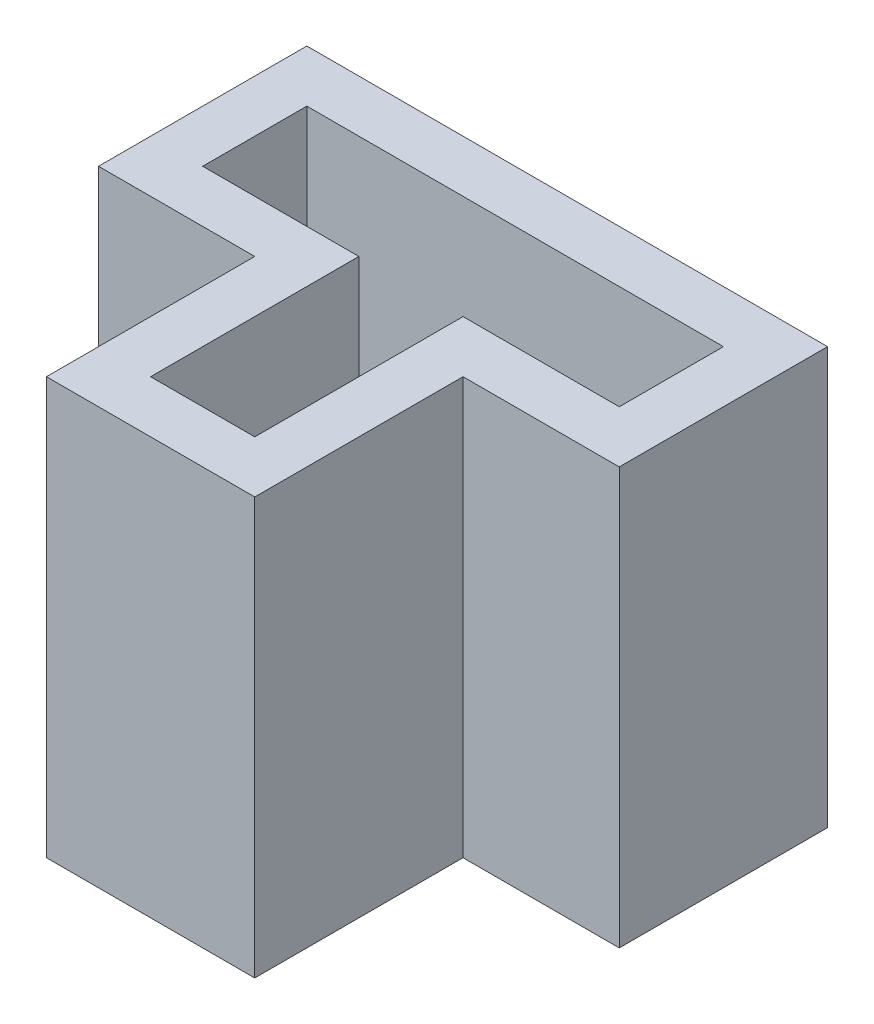
from build123d import *

# Parameters (mm, degrees)
BOSS_EXTRUDE2_DEPTH = 40
CUT_EXTRUDE1_DEPTH  = 40


with BuildPart() as part:
    # Sketch1 → Boss-Extrude2 (new body)
    with BuildSketch(Plane(origin=(0, 0, 0), x_dir=(1, 0, 0), z_dir=(0, 1, 0))):
        Polygon((32.948717949, 4.188034188), (-17.051282051, 4.188034188), (-17.051282051, -15.811965812), (-2.051282051, -15.811965812), (-2.051282051, -35.811965812), (17.948717949, -35.811965812), (17.948717949, -15.811965812), (32.948717949, -15.811965812), align=None)
    extrude(amount=-BOSS_EXTRUDE2_DEPTH)

    # Sketch3 → Cut-Extrude1 (cut)
    with BuildSketch(Plane(origin=(0, 0, 0), x_dir=(1, 0, 0), z_dir=(0, 1, 0))):
        Polygon((27.948717949, -0.811965812), (-12.051282051, -0.811965812), (-12.051282051, -10.811965812), (2.948717949, -10.811965812), (2.948717949, -30.811965812), (12.948717949, -30.811965812), (12.948717949, -10.811965812), (27.948717949, -10.811965812), align=None)
    extrude(amount=-CUT_EXTRUDE1_DEPTH, mode=Mode.SUBTRACT)


solid = part.part
